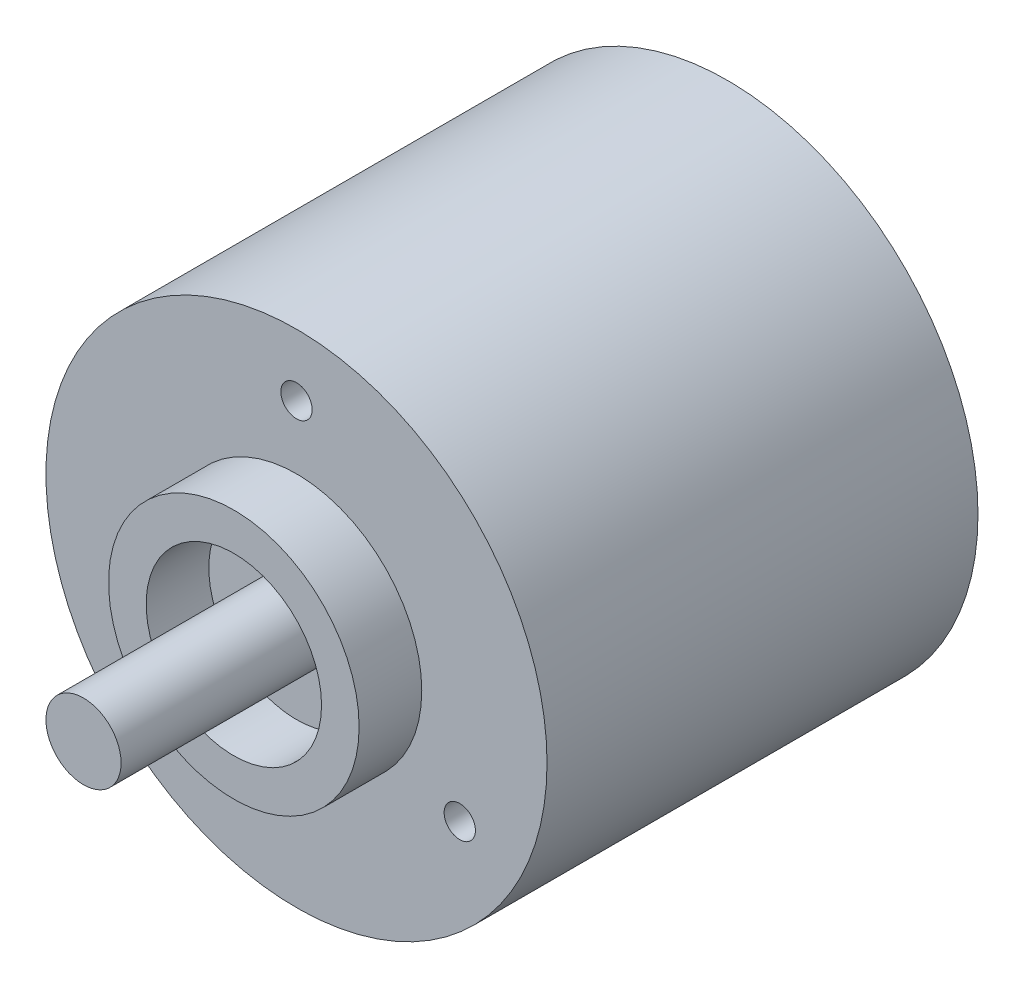
from build123d import *

# Parameters (mm, degrees)
ESQUISSE1_R             = 20
BOSS_EXTRU_1_DEPTH      = 34.4
ESQUISSE2_R             = 10
ESQUISSE2_R_2           = 7
BOSS_EXTRU_2_DEPTH      = 5
ESQUISSE3_R             = 3
BOSS_EXTRU_3_DEPTH      = 17
ESQUISSE4_R             = 1.25
ENL_V_MAT_EXTRU_1_DEPTH = 7.9


with BuildPart() as part:
    # Esquisse1 → Boss.-Extru.1 (new body)
    with BuildSketch(Plane.XY):
        Circle(ESQUISSE1_R)
    extrude(amount=-BOSS_EXTRU_1_DEPTH)

    # Esquisse2 → Boss.-Extru.2 (add)
    with BuildSketch(Plane.XY):
        Circle(ESQUISSE2_R)
        Circle(ESQUISSE2_R_2, mode=Mode.SUBTRACT)
    extrude(amount=BOSS_EXTRU_2_DEPTH)

    # Esquisse3 → Boss.-Extru.3 (add)
    with BuildSketch(Plane.XY):
        Circle(ESQUISSE3_R)
    extrude(amount=BOSS_EXTRU_3_DEPTH)

    # Esquisse4 → Enlèv. mat.-Extru.1 (cut)
    with BuildSketch(Plane.XY):
        with Locations((0, 15.05)):
            Circle(ESQUISSE4_R)
        with Locations((13.033682327, -7.525)):
            Circle(ESQUISSE4_R)
        with Locations((-13.033682327, -7.525)):
            Circle(ESQUISSE4_R)
    extrude(amount=-ENL_V_MAT_EXTRU_1_DEPTH, mode=Mode.SUBTRACT)


solid = part.part
